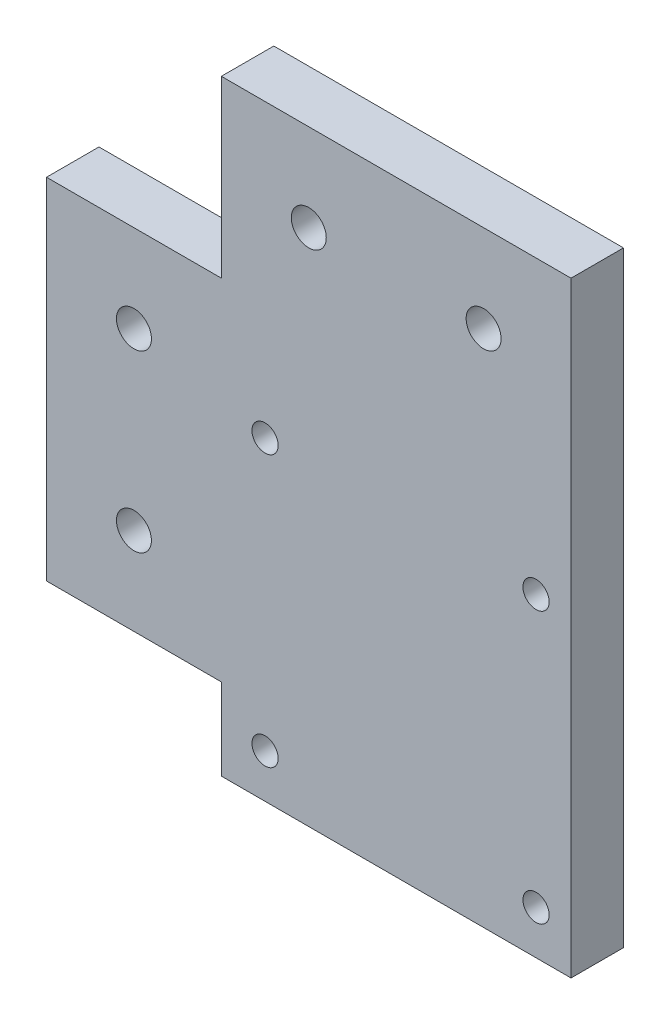
from build123d import *

# Parameters (mm, degrees)
SKETCH1_R           = 2
SKETCH1_R_2         = 1.5
BOSS_EXTRUDE1_DEPTH = 6


with BuildPart() as part:
    # Sketch1 → Boss-Extrude1 (new body)
    with BuildSketch(Plane.XY):
        Polygon((20, 0), (60, 0), (60, -20), (60, -69.331923123), (20, -69.331923123), (20, -60), (0, -60), (0, -20), (20, -20), align=None)
        with Locations((50, -10)):
            Circle(SKETCH1_R, mode=Mode.SUBTRACT)
        with Locations((30, -10)):
            Circle(SKETCH1_R, mode=Mode.SUBTRACT)
        with Locations((10, -50)):
            Circle(SKETCH1_R, mode=Mode.SUBTRACT)
        with Locations((10, -30)):
            Circle(SKETCH1_R, mode=Mode.SUBTRACT)
        with Locations((25, -64.331923123)):
            Circle(SKETCH1_R_2, mode=Mode.SUBTRACT)
        with Locations((24.997348671, -33.331923237)):
            Circle(SKETCH1_R_2, mode=Mode.SUBTRACT)
        with Locations((56, -64.331923123)):
            Circle(SKETCH1_R_2, mode=Mode.SUBTRACT)
        with Locations((55.997348671, -33.331923123)):
            Circle(SKETCH1_R_2, mode=Mode.SUBTRACT)
    extrude(amount=BOSS_EXTRUDE1_DEPTH)


solid = part.part
